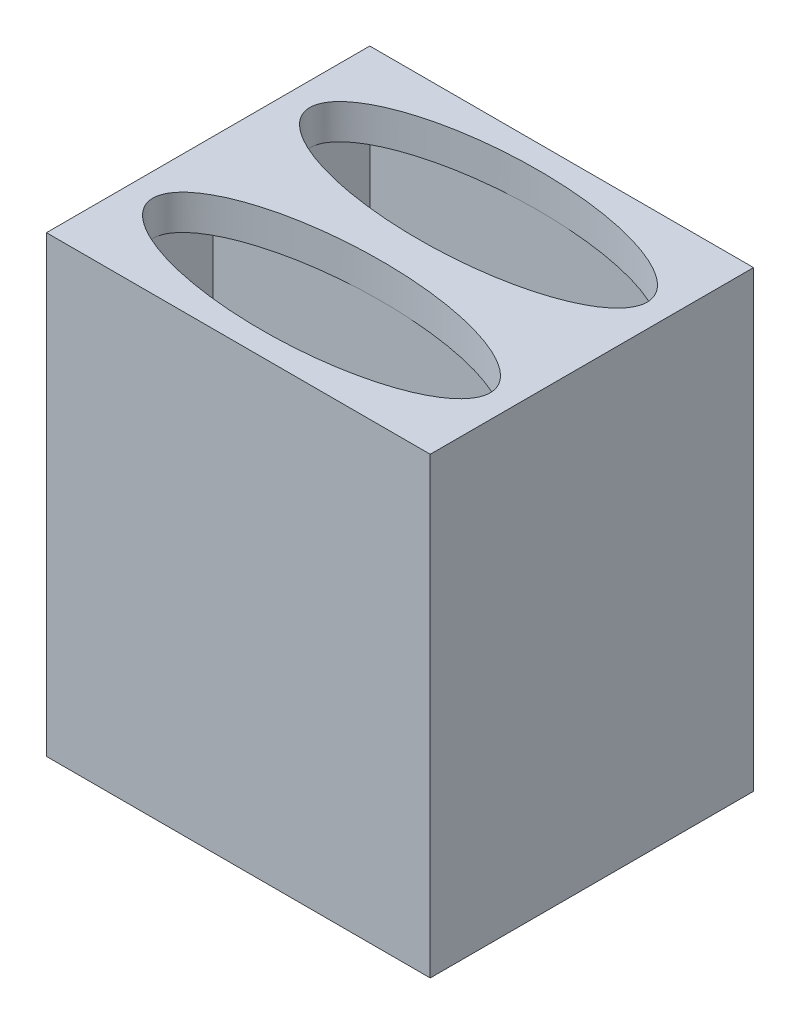
from build123d import *

# Parameters (mm, degrees)
SKETCH_1_W             = 33
SKETCH_1_H             = 14.3
SKETCH_1_W_2           = 29
SKETCH_1_H_2           = 10.3
EXTRUDE_2_DEPTH        = 36
SKETCH_2_W             = 33
SKETCH_2_H             = 14.3
SKETCH_2_RX            = 14.5
SKETCH_2_RY            = 5.15
EXTRUDE_3_DEPTH        = 3
PATTERN_LINEAR_1_COUNT = 2
PATTERN_LINEAR_1_PITCH = 13.5


with BuildPart() as part:
    # 草图1 → 凸台-拉伸2 (new body)
    with BuildSketch(Plane(origin=(0, 0, 0), x_dir=(1, 0, 0), z_dir=(0, 1, 0))):
        Rectangle(SKETCH_1_W, SKETCH_1_H)
        Rectangle(SKETCH_1_W_2, SKETCH_1_H_2, mode=Mode.SUBTRACT)
    extrude_2 = extrude(amount=EXTRUDE_2_DEPTH)

    # 草图2 → 凸台-拉伸3 (add)
    with BuildSketch(Plane(origin=(0, 36, 0), x_dir=(1, 0, 0), z_dir=(0, 1, 0))):
        Rectangle(SKETCH_2_W, SKETCH_2_H)
        with Locations(Location((0, 0), (0, 0, 0))):
            Ellipse(SKETCH_2_RX, SKETCH_2_RY, mode=Mode.SUBTRACT)
    extrude_3 = extrude(amount=EXTRUDE_3_DEPTH)

    # 阵列(线性)1: 凸台-拉伸2, 凸台-拉伸3 ×2
    with Locations(*[(0, 0, i * PATTERN_LINEAR_1_PITCH) for i in range(1, PATTERN_LINEAR_1_COUNT)]):
        add(extrude_2)
        add(extrude_3)


solid = part.part
